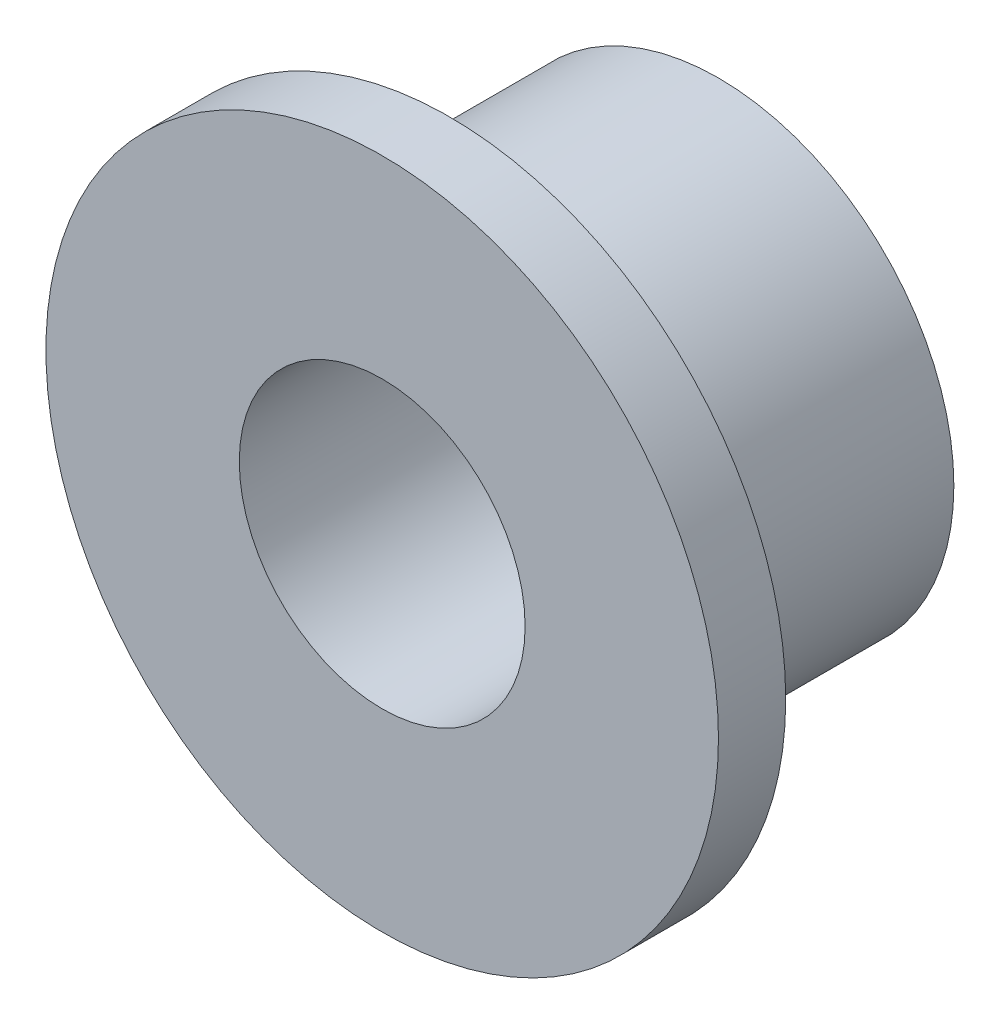
from build123d import *

# Parameters (mm, degrees)
SKETCH1_R           = 7
SKETCH1_R_2         = 4.25
BOSS_EXTRUDE1_DEPTH = 10
BOSS_EXTRUDE2_START = -2
SKETCH2_R           = 10
SKETCH2_R_2         = 7
BOSS_EXTRUDE2_DEPTH = 2


with BuildPart() as part:
    # Sketch1 → Boss-Extrude1 (new body)
    with BuildSketch(Plane.XY):
        Circle(SKETCH1_R)
        Circle(SKETCH1_R_2, mode=Mode.SUBTRACT)
    extrude(amount=BOSS_EXTRUDE1_DEPTH)

    # Sketch2 → Boss-Extrude2 (add)
    with BuildSketch(Plane.XY.offset(10).offset(BOSS_EXTRUDE2_START)):
        Circle(SKETCH2_R)
        Circle(SKETCH2_R_2, mode=Mode.SUBTRACT)
    extrude(amount=BOSS_EXTRUDE2_DEPTH)


solid = part.part
